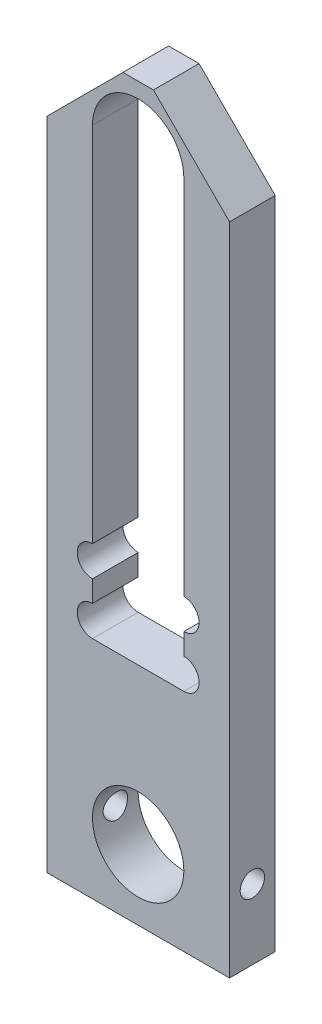
from build123d import *

# Parameters (mm, degrees)
BASE_EXTRUSION_DEPTH    = 15
ESQUISSE2_R             = 15
ENL_V_MAT_EXTRU_1_DEPTH = 15
ENL_V_MAT_EXTRU_2_DEPTH = 15
ESQUISSE4_R             = 4
ENL_V_MAT_EXTRU_3_DEPTH = 248.840674628


with BuildPart() as part:
    # Esquisse1 → Base-Extrusion (new body)
    with BuildSketch(Plane.XY):
        Polygon((0, 215), (25, 240), (35, 240), (60, 215), (60, 0), (0, 0), align=None)
    extrude(amount=BASE_EXTRUSION_DEPTH)

    # Esquisse2 → Enlèv. mat.-Extru.1 (cut)
    with BuildSketch(Plane.XY.offset(15)):
        with Locations((30, 23)):
            Circle(ESQUISSE2_R)
    extrude(amount=-ENL_V_MAT_EXTRU_1_DEPTH, mode=Mode.SUBTRACT)

    # Esquisse3 → Enlèv. mat.-Extru.2 (cut)
    with BuildSketch(Plane.XY.offset(15)):
        with BuildLine():
            Line((45, 91), (45, 84))
            ThreePointArc((45, 84), (50, 79), (45, 74))
            Line((45, 74), (15, 74))
            ThreePointArc((15, 74), (10, 79), (15, 84))
            Line((15, 84), (15, 91))
            ThreePointArc((15, 91), (10, 96), (15, 101))
            Line((15, 101), (15, 220))
            ThreePointArc((15, 220), (30, 235), (45, 220))
            Line((45, 220), (45, 101))
            ThreePointArc((45, 101), (50, 96), (45, 91))
        make_face()
    extrude(amount=-ENL_V_MAT_EXTRU_2_DEPTH, mode=Mode.SUBTRACT)

    # Esquisse4 → Enlèv. mat.-Extru.3 (cut, through all)
    with BuildSketch(Plane.ZY):
        with Locations((7.5, 23)):
            Circle(ESQUISSE4_R)
    extrude(amount=-ENL_V_MAT_EXTRU_3_DEPTH, mode=Mode.SUBTRACT)


solid = part.part
